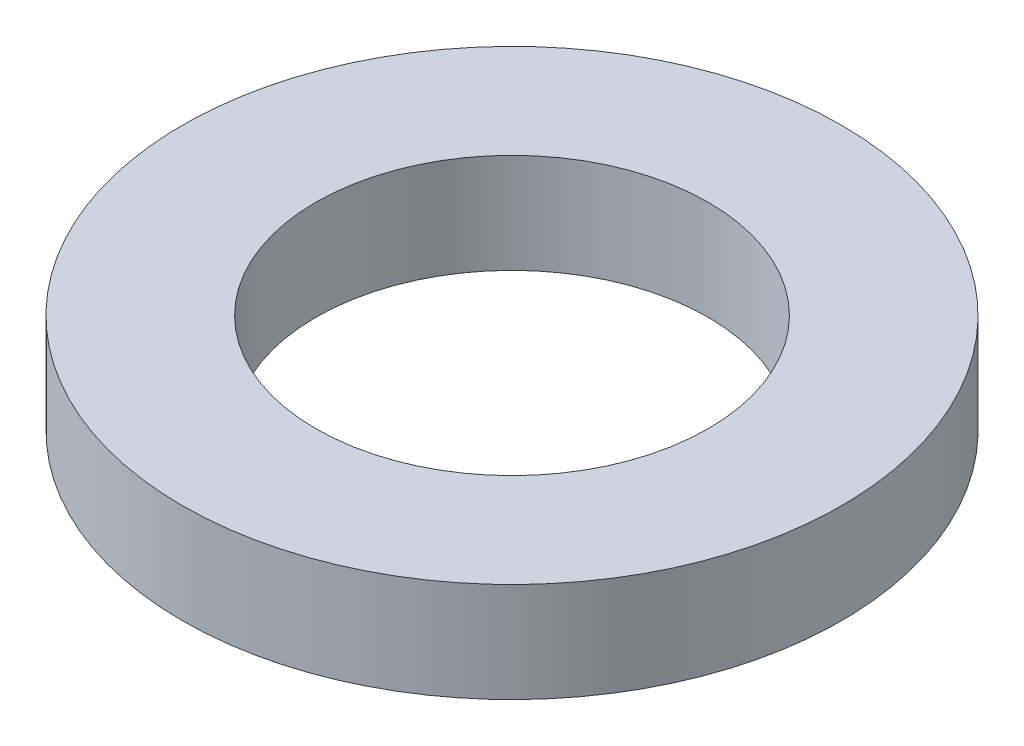
from build123d import *

# Parameters (mm, degrees)
SKETCH1_R           = 4.2
SKETCH1_R_2         = 2.5
BOSS_EXTRUDE1_DEPTH = 1.27


with BuildPart() as part:
    # Sketch1 → Boss-Extrude1 (new body)
    with BuildSketch(Plane(origin=(0, 0, 0), x_dir=(1, 0, 0), z_dir=(0, 1, 0))):
        with Locations(Location((0, 0, 0), (0, 0, 270))):
            Circle(SKETCH1_R)
        with Locations(Location((0, 0, 0), (0, 0, 270))):
            Circle(SKETCH1_R_2, mode=Mode.SUBTRACT)
    extrude(amount=BOSS_EXTRUDE1_DEPTH)


solid = part.part
